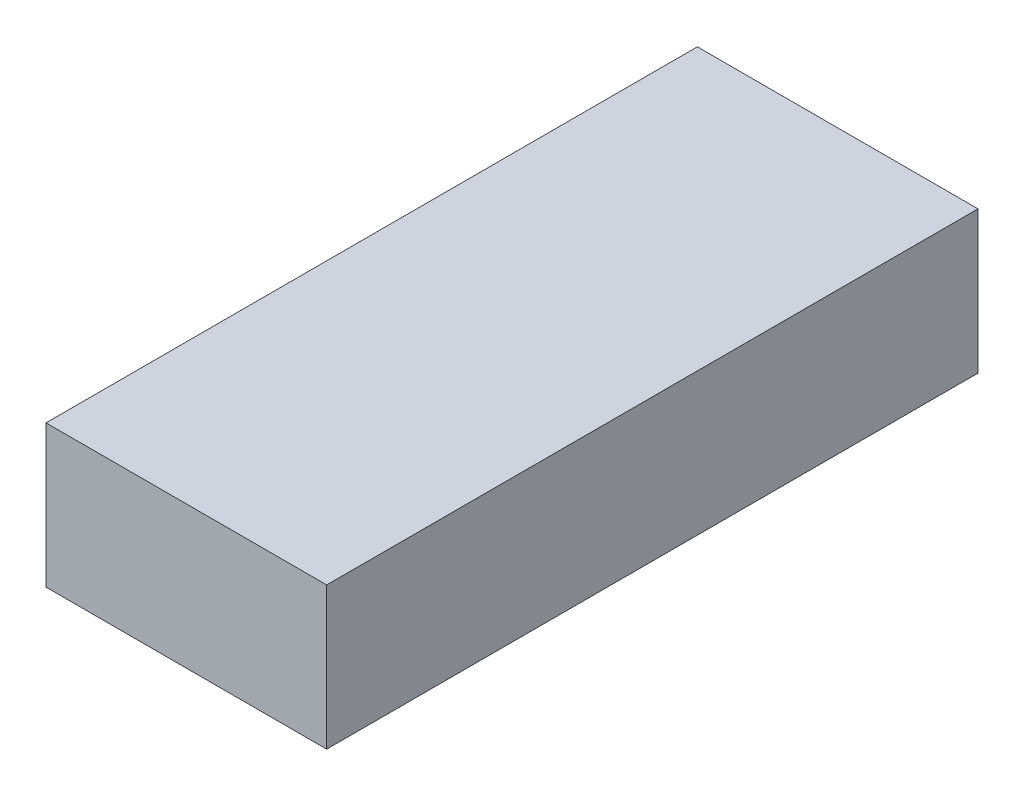
from build123d import *

# Parameters (mm, degrees)
SKETCH_2_W      = 129.275089844
SKETCH_2_H      = 65.522990743
EXTRUDE_1_DEPTH = 300


with BuildPart() as part:
    # Эскиз2 → Бобышка-Вытянуть1 (new body)
    with BuildSketch(Plane.XY):
        with Locations((3.187604955, -1.593802478)):
            Rectangle(SKETCH_2_W, SKETCH_2_H)
    extrude(amount=EXTRUDE_1_DEPTH)


solid = part.part
